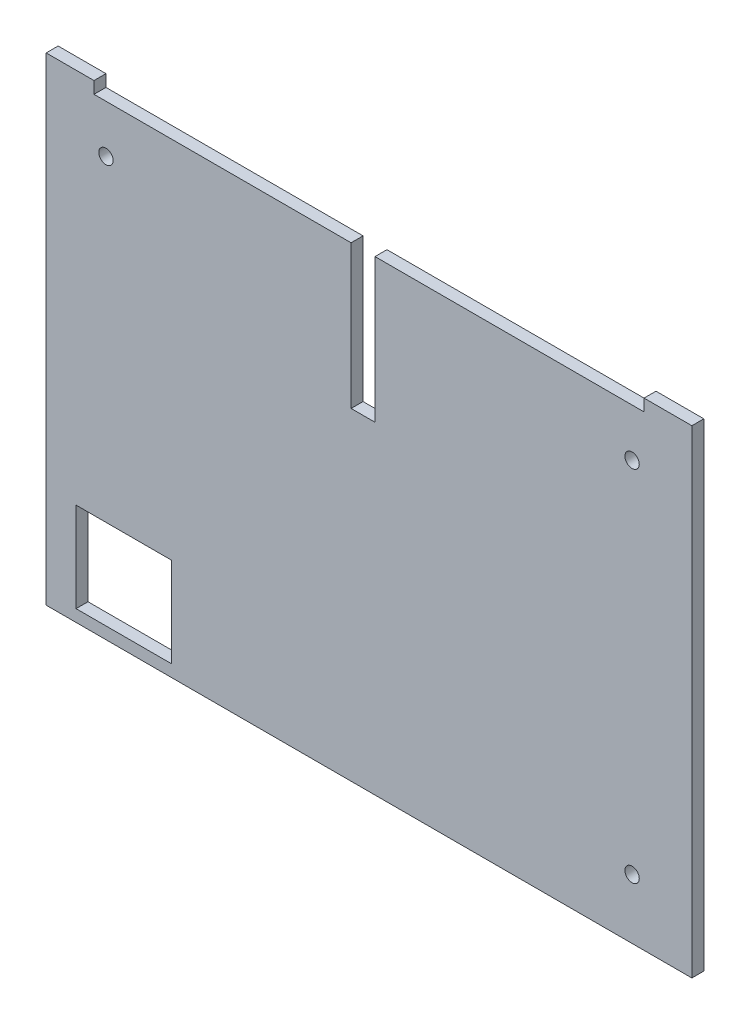
from build123d import *

# Parameters (mm, degrees)
BOSS_EXTRU_2_DEPTH        = 5
ESQUISSE2_R               = 3
ENL_V_MAT_EXTRU_1_DEPTH   = 169.07736314
SYM_TRIE2_COPY_1_SKETCH_R = 3
SYM_TRIE2_COPY_1_DEPTH    = 169.07736314
ESQUISSE4_W               = 40
ESQUISSE4_H               = 37.5
ENL_V_MAT_EXTRU_2_DEPTH   = 60
ESQUISSE5_W               = 45
ESQUISSE5_H               = 5
BOSS_EXTRU_3_DEPTH        = 60
ESQUISSE7_W               = 230
ESQUISSE7_H               = 5
ENL_V_MAT_EXTRU_3_DEPTH   = 5
ESQUISSE11_W              = 15
ESQUISSE11_H              = 60
ENL_V_MAT_EXTRU_4_DEPTH   = 10
ESQUISSE12_W              = 5
ESQUISSE12_H              = 60
BOSS_EXTRU_4_DEPTH        = 5


with BuildPart() as part:
    # Esquisse1 → Boss.-Extru.2 (new body)
    with BuildSketch(Plane.XY):
        Polygon((135, 100), (-135, 100), (-135, 22.5), (-90, 22.5), (-90, -22.5), (-135, -22.5), (-135, -100), (135, -100), align=None)
    extrude(amount=BOSS_EXTRU_2_DEPTH)

    # Esquisse2 → Enlèv. mat.-Extru.1 (cut, through all)
    with BuildSketch(Plane.XY.offset(5)):
        with Locations((110, -75)):
            Circle(ESQUISSE2_R)
    enl_v_mat_extru_1 = extrude(amount=-ENL_V_MAT_EXTRU_1_DEPTH, mode=Mode.SUBTRACT)

    # Symétrie1: Enlèv. mat.-Extru.1 across plane
    add(enl_v_mat_extru_1.mirror(Plane(origin=(0, 0, 0), x_dir=(0, 0, 1), z_dir=(1, 0, 0))), mode=Mode.SUBTRACT)

    # Symétrie2: Enlèv. mat.-Extru.1 across plane
    add(enl_v_mat_extru_1.mirror(Plane(origin=(0, 0, 0), x_dir=(0, 0, 1), z_dir=(0, -1, 0))), mode=Mode.SUBTRACT)

    # Symétrie2 copy 1 sketch → Symétrie2 copy 1 (cut, through all)
    with BuildSketch(Plane(origin=(0, 0, 5), x_dir=(-1, 0, 0), z_dir=(0, 0, 1))):
        with Locations((110, -75)):
            Circle(SYM_TRIE2_COPY_1_SKETCH_R)
    extrude(amount=-SYM_TRIE2_COPY_1_DEPTH, mode=Mode.SUBTRACT)

    # Esquisse4 → Enlèv. mat.-Extru.2 (cut)
    with BuildSketch(Plane.XY.offset(5)):
        with Locations((-102.5, -76.25)):
            Rectangle(ESQUISSE4_W, ESQUISSE4_H)
    extrude(amount=-ENL_V_MAT_EXTRU_2_DEPTH, mode=Mode.SUBTRACT)

    # Esquisse5 → Boss.-Extru.3 (add)
    with BuildSketch(Plane(origin=(0, -22.5, 0), x_dir=(1, 0, 0), z_dir=(0, 1, 0))):
        with Locations((-112.5, -2.5)):
            Rectangle(ESQUISSE5_W, ESQUISSE5_H)
    extrude(amount=BOSS_EXTRU_3_DEPTH)

    # Esquisse7 → Enlèv. mat.-Extru.3 (cut)
    with BuildSketch(Plane(origin=(0, 100, 0), x_dir=(1, 0, 0), z_dir=(0, 1, 0))):
        with Locations((0, -2.5)):
            Rectangle(ESQUISSE7_W, ESQUISSE7_H)
    extrude(amount=-ENL_V_MAT_EXTRU_3_DEPTH, mode=Mode.SUBTRACT)

    # Esquisse11 → Enlèv. mat.-Extru.4 (cut)
    with BuildSketch(Plane(origin=(0, 0, 0), x_dir=(-1, 0, 0), z_dir=(0, 0, -1))):
        with Locations((0, 65)):
            Rectangle(ESQUISSE11_W, ESQUISSE11_H)
    extrude(amount=-ENL_V_MAT_EXTRU_4_DEPTH, mode=Mode.SUBTRACT)

    # Esquisse12 → Boss.-Extru.4 (add)
    with BuildSketch(Plane.ZY.offset(-7.5)):
        with Locations((2.5, 65)):
            Rectangle(ESQUISSE12_W, ESQUISSE12_H)
    extrude(amount=BOSS_EXTRU_4_DEPTH)


solid = part.part
